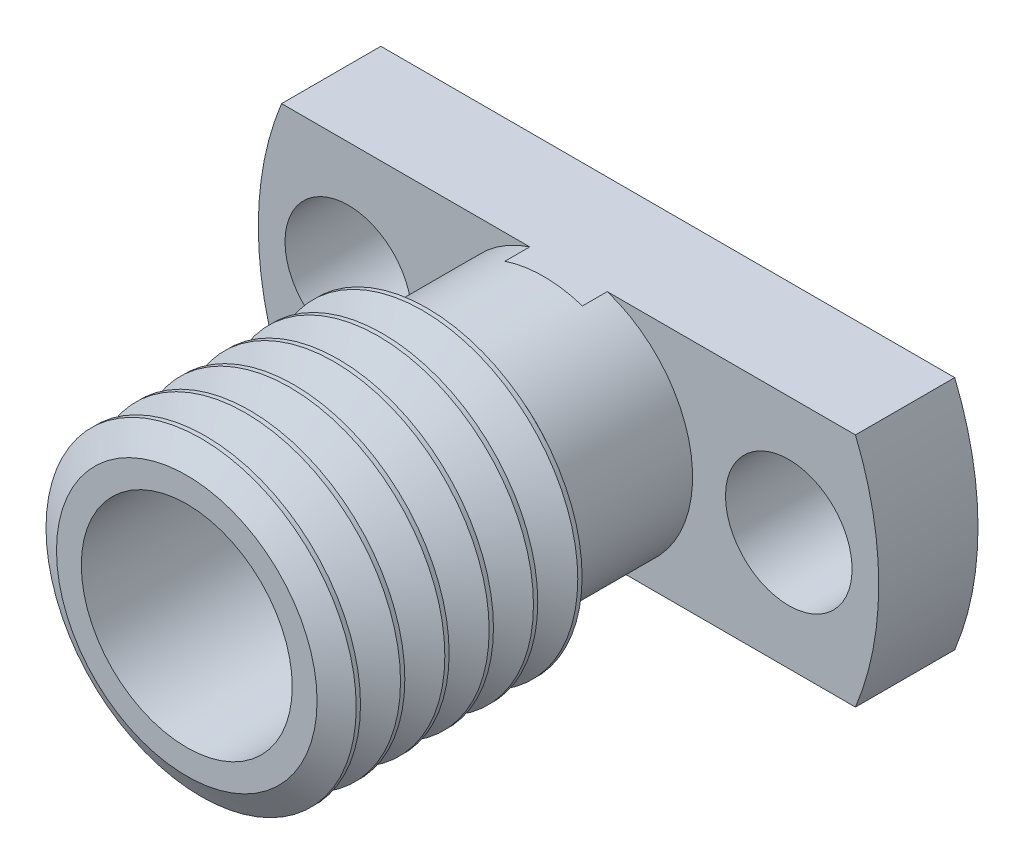
from build123d import *

# Parameters (mm, degrees)
SKETCH5_OUTSIDE_W   = 23.578
SKETCH5_OUTSIDE_H   = 23.578
SKETCH5_OUTSIDE_R   = 1.2954
CE_00_500_355_DEPTH = 2.54
LPATTERN4_COUNT     = 6
LPATTERN4_PITCH     = 0.907142857


with BuildPart() as part:
    # Sketch1 → Revolve1 (revolve)
    with BuildSketch(Plane(origin=(0, 0, 0), x_dir=(0, 0, -1), z_dir=(1, 0, 0)), mode=Mode.PRIVATE) as revolve1_sk:
        Polygon((-2.032, 2.54), (-4.512366142, 2.54), (-4.878983563, 3.175), (-9.553072205, 3.175), (-9.846366142, 2.667), (-9.846366142, 2.159), (-6.793879368, 2.159), (-6.793879368, 1.524), (-3.100370371, 1.524), (-3.100370371, 0.762), (0, 0.762), (0, 8.255), (-2.032, 8.255), align=None)
    revolve(revolve1_sk.sketch.rotate(Axis((0, 0, 6.793879368), (0, 0, -1)), 90), axis=Axis((0, 0, 6.793879368), (0, 0, -1)))

    # Sketch5 outside → CE-00 500 355 (cut)
    # profile 1 of 3: a face of its own
    with BuildSketch(Plane.XY):
        Rectangle(SKETCH5_OUTSIDE_W, SKETCH5_OUTSIDE_H)
        with BuildLine():
            Line((5.873664189, -2.413), (-5.873664189, -2.413))
            ThreePointArc((-5.873664189, -2.413), (-6.35, 0), (-5.873664189, 2.413))
            Line((-5.873664189, 2.413), (5.873664189, 2.413))
            ThreePointArc((5.873664189, 2.413), (6.35, 0), (5.873664189, -2.413))
        make_face(mode=Mode.SUBTRACT)
    # profile 2 of 3: a face of its own
    with BuildSketch(Plane.XY):
        with Locations(Location((-4.5085, 0, 0), (0, 0, 180))):
            Circle(SKETCH5_OUTSIDE_R)
    # profile 3 of 3: a face of its own
    with BuildSketch(Plane.XY):
        with Locations(Location((4.5085, 0, 0), (0, 0, 180))):
            Circle(SKETCH5_OUTSIDE_R)
    extrude(amount=CE_00_500_355_DEPTH, mode=Mode.SUBTRACT)

    # Sketch4 → Cut-Revolve1 (revolve, cut)
    with BuildSketch(Plane(origin=(0, 0, 0), x_dir=(0, 0, -1), z_dir=(1, 0, 0)), mode=Mode.PRIVATE) as cut_revolve1_sk:
        Polygon((-9.523742812, 3.2766), (-9.055506686, 2.465591241), (-8.587270561, 3.2766), align=None)
    cut_revolve1 = revolve(cut_revolve1_sk.sketch.rotate(Axis((0, 0, -0.492318307), (0, 0, 1)), 270), axis=Axis((0, 0, -0.492318307), (0, 0, 1)), mode=Mode.SUBTRACT)

    # LPattern4: Cut-Revolve1 ×6
    with Locations(*[(0, 0, -i * LPATTERN4_PITCH) for i in range(1, LPATTERN4_COUNT)]):
        add(cut_revolve1, mode=Mode.SUBTRACT)


solid = part.part
